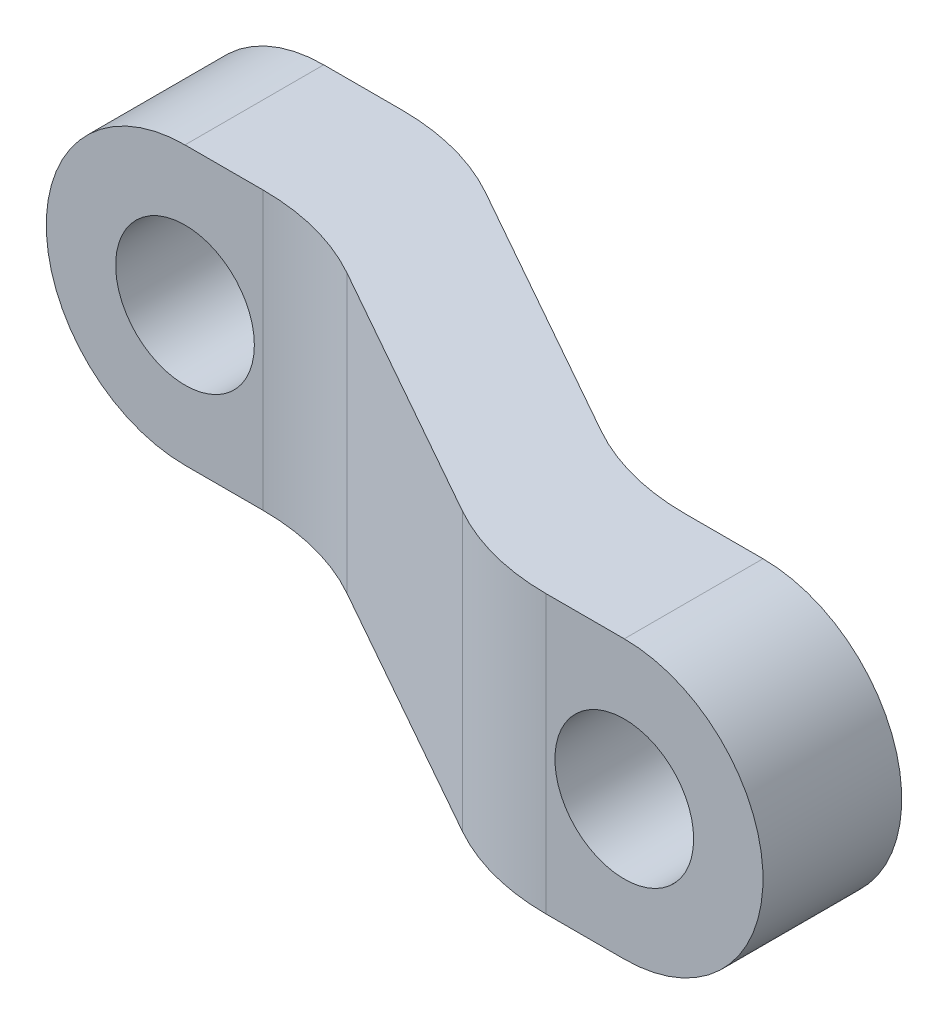
from build123d import *

# Parameters (mm, degrees)
BOSS_EXTRUDE1_DEPTH      = 3
BOSS_EXTRUDE1_DEPTH_BACK = 3
CUT_EXTRUDE1_DEPTH       = 3
CUT_EXTRUDE1_DEPTH_BACK  = 3
SKETCH2_R                = 1.5
CUT_EXTRUDE3_DEPTH       = 3
CUT_EXTRUDE3_DEPTH_BACK  = 3
SKETCH4_R                = 1.5
FILLET1_R                = 5


with BuildPart() as part:
    # Sketch3 → Boss-Extrude1 (new, two sides: drawn at the far end of the back side and taken through both)
    with BuildSketch(Plane(origin=(0, 0, 0), x_dir=(1, 0, 0), z_dir=(0, 1, 0)).offset(-BOSS_EXTRUDE1_DEPTH_BACK)):
        Polygon((-3, -1.5), (3, -1.5), (3, 1.5), (-3, 1.5), (-11, 6), (-17, 6), (-17, 3), (-11, 3), align=None)
    extrude(amount=BOSS_EXTRUDE1_DEPTH + BOSS_EXTRUDE1_DEPTH_BACK)

    # Sketch2 → Cut-Extrude1 (cut, two sides: drawn at the far end of the back side and taken through both)
    with BuildSketch(Plane.XY.offset(-CUT_EXTRUDE1_DEPTH_BACK)):
        with BuildLine():
            ThreePointArc((3, 0), (2.121320338, -2.121320349), (-1.5e-08, -3))
            Line((-1.5e-08, -3), (3, -3))
            Line((3, -3), (3, 0))
        make_face()
        with BuildLine():
            ThreePointArc((0, 3), (2.121320344, 2.121320344), (3, 0))
            Line((3, 0), (3, 3))
            Line((3, 3), (0, 3))
        make_face()
        Circle(SKETCH2_R)
    extrude(amount=CUT_EXTRUDE1_DEPTH + CUT_EXTRUDE1_DEPTH_BACK, mode=Mode.SUBTRACT)

    # Sketch4 → Cut-Extrude3 (cut, two sides: drawn at the far end of the back side and taken through both)
    with BuildSketch(Plane.XY.offset(-3).offset(-CUT_EXTRUDE3_DEPTH_BACK)):
        with BuildLine():
            ThreePointArc((-17, -3.1e-08), (-16.121320355, 2.121320333), (-14, 3))
            Line((-14, 3), (-17, 3))
            Line((-17, 3), (-17, -3.1e-08))
        make_face()
        with BuildLine():
            ThreePointArc((-14, -3), (-16.121320333, -2.121320355), (-17, -3.1e-08))
            Line((-17, -3.1e-08), (-17, -3))
            Line((-17, -3), (-14, -3))
        make_face()
        with Locations((-14, 0)):
            Circle(SKETCH4_R)
    extrude(amount=CUT_EXTRUDE3_DEPTH + CUT_EXTRUDE3_DEPTH_BACK, mode=Mode.SUBTRACT)

    # Fillet1
    fillet1_edges = [part.edges().sort_by_distance(p)[0] for p in [
        (-11, 0, -3),
        (-3, 0, 1.5),
        (-3, 0, -1.5),
        (-11, 0, -6),
    ]]
    fillet(fillet1_edges, radius=FILLET1_R)


solid = part.part
